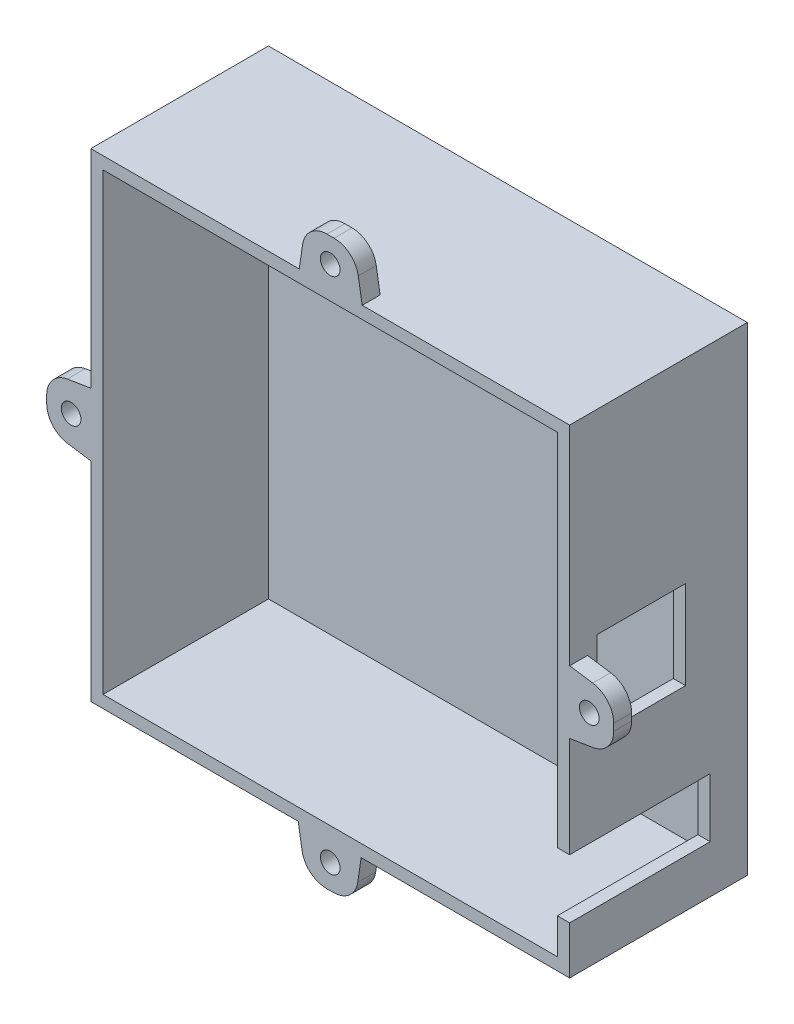
from build123d import *

# Parameters (mm, degrees)
BOSS_EXTRUDE1_START = -40.195413
SKETCH2_R           = 2.54
SKETCH2_W           = 117.366510392
SKETCH2_H           = 117.366510392
BOSS_EXTRUDE1_DEPTH = 40.195413
SKETCH8_W           = 123.716510392
SKETCH8_H           = 123.716510392
SKETCH8_W_2         = 117.366510392
SKETCH8_H_2         = 117.366510392
BOSS_EXTRUDE6_DEPTH = 38.1
SKETCH9_W           = 123.716510392
SKETCH9_H           = 123.716510392
BOSS_EXTRUDE7_DEPTH = 3.175
SKETCH11_W          = 203.085481381
SKETCH11_H          = 253.856851726
CUT_EXTRUDE3_DEPTH  = 35.56
SKETCH14_W          = 36.322
SKETCH14_H          = 15.24
SKETCH14_W_2        = 22.86
SKETCH14_H_2        = 22.86
CUT_EXTRUDE4_DEPTH  = 12.7


with BuildPart() as part:
    # Sketch2 → Boss-Extrude1 (new body)
    with BuildSketch(Plane.XY.offset(BOSS_EXTRUDE1_START)):
        with BuildLine():
            Line((1514.374964129, -9.898719074), (1513.372529957, -3.825593235))
            ThreePointArc((1513.372529957, -3.825593235), (1511.215570373, -0.017767746), (1507.107304519, 1.490264506))
            Line((1507.107304519, 1.490264506), (1506.145090959, 1.490264506))
            Line((1506.145090959, 1.490264506), (1505.274868714, 1.490264506))
            ThreePointArc((1505.274868714, 1.490264506), (1501.126253206, -0.052294453), (1498.993223216, -3.930526246))
            Line((1498.993223216, -3.930526246), (1498.110381295, -9.898719074))
            Line((1498.110381295, -9.898719074), (1494.935381295, -9.898719074))
            Line((1494.935381295, -9.898719074), (1444.2526074, -9.898719074))
            Line((1444.2526074, -9.898719074), (1444.2526074, -59.236149034))
            Line((1444.2526074, -59.236149034), (1444.2526074, -63.492872737))
            Line((1444.2526074, -63.492872737), (1438.179481561, -64.495306909))
            ThreePointArc((1438.179481561, -64.495306909), (1434.371656072, -66.652266493), (1432.86362382, -70.760532347))
            Line((1432.86362382, -70.760532347), (1432.86362382, -71.722745907))
            Line((1432.86362382, -71.722745907), (1432.86362382, -72.592968152))
            ThreePointArc((1432.86362382, -72.592968152), (1434.406182779, -76.74158366), (1438.284414571, -78.874613651))
            Line((1438.284414571, -78.874613651), (1444.2526074, -79.757455571))
            Line((1444.2526074, -79.757455571), (1444.2526074, -82.932455571))
            Line((1444.2526074, -82.932455571), (1444.2526074, -133.615229466))
            Line((1444.2526074, -133.615229466), (1493.590037359, -133.615229466))
            Line((1493.590037359, -133.615229466), (1497.846761063, -133.615229466))
            Line((1497.846761063, -133.615229466), (1498.849195235, -139.688355305))
            ThreePointArc((1498.849195235, -139.688355305), (1501.006154818, -143.496180794), (1505.114420673, -145.004213046))
            Line((1505.114420673, -145.004213046), (1506.076634233, -145.004213046))
            Line((1506.076634233, -145.004213046), (1506.946856478, -145.004213046))
            ThreePointArc((1506.946856478, -145.004213046), (1511.095471986, -143.461654087), (1513.228501976, -139.583422295))
            Line((1513.228501976, -139.583422295), (1514.111343897, -133.615229466))
            Line((1514.111343897, -133.615229466), (1517.286343897, -133.615229466))
            Line((1517.286343897, -133.615229466), (1567.969117792, -133.615229466))
            Line((1567.969117792, -133.615229466), (1567.969117792, -84.277799507))
            Line((1567.969117792, -84.277799507), (1567.969117792, -80.021075803))
            Line((1567.969117792, -80.021075803), (1574.042243631, -79.018641631))
            ThreePointArc((1574.042243631, -79.018641631), (1577.85006912, -76.861682048), (1579.358101372, -72.753416193))
            Line((1579.358101372, -72.753416193), (1579.358101372, -71.791202633))
            Line((1579.358101372, -71.791202633), (1579.358101372, -70.920980388))
            ThreePointArc((1579.358101372, -70.920980388), (1577.815542413, -66.77236488), (1573.93731062, -64.63933489))
            Line((1573.93731062, -64.63933489), (1567.969117792, -63.756492969))
            Line((1567.969117792, -63.756492969), (1567.969117792, -60.581492969))
            Line((1567.969117792, -60.581492969), (1567.969117792, -9.898719074))
            Line((1567.969117792, -9.898719074), (1518.631687833, -9.898719074))
            Line((1518.631687833, -9.898719074), (1514.374964129, -9.898719074))
        make_face()
        with Locations((1506.110862596, -138.695229466)):
            Circle(SKETCH2_R, mode=Mode.SUBTRACT)
        with Locations((1439.1726074, -71.75697427)):
            Circle(SKETCH2_R, mode=Mode.SUBTRACT)
        with Locations((1506.110862596, -71.75697427)):
            Rectangle(SKETCH2_W, SKETCH2_H, mode=Mode.SUBTRACT)
        with Locations((1506.110862596, -4.818719074)):
            Circle(SKETCH2_R, mode=Mode.SUBTRACT)
        with Locations((1573.049117792, -71.75697427)):
            Circle(SKETCH2_R, mode=Mode.SUBTRACT)
    extrude(amount=BOSS_EXTRUDE1_DEPTH)

    # Sketch8 → Boss-Extrude6 (add)
    with BuildSketch(Plane(origin=(0, 0, -40.195413), x_dir=(-1, 0, 0), z_dir=(0, 0, -1))):
        with Locations((-1506.110862596, -71.75697427)):
            Rectangle(SKETCH8_W, SKETCH8_H)
        with Locations((-1506.110862596, -71.75697427)):
            Rectangle(SKETCH8_W_2, SKETCH8_H_2, mode=Mode.SUBTRACT)
    extrude(amount=BOSS_EXTRUDE6_DEPTH)

    # Sketch9 → Boss-Extrude7 (add)
    with BuildSketch(Plane(origin=(0, 0, -78.295413), x_dir=(-1, 0, 0), z_dir=(0, 0, -1))):
        with Locations((-1506.110862596, -71.75697427)):
            Rectangle(SKETCH9_W, SKETCH9_H)
    extrude(amount=BOSS_EXTRUDE7_DEPTH)

    # Sketch11 → Cut-Extrude3 (cut)
    with BuildSketch(Plane.XY):
        with Locations((1484.541394478, -61.275179675)):
            Rectangle(SKETCH11_W, SKETCH11_H)
    extrude(amount=-CUT_EXTRUDE3_DEPTH, mode=Mode.SUBTRACT)

    # Sketch14 → Cut-Extrude4 (cut)
    with BuildSketch(Plane(origin=(1567.969117792, 0, 0), x_dir=(0, 0, -1), z_dir=(1, 0, 0))):
        with Locations((53.721, -113.66697427)):
            Rectangle(SKETCH14_W, SKETCH14_H)
        with Locations((54.102, -71.75697427)):
            Rectangle(SKETCH14_W_2, SKETCH14_H_2)
    extrude(amount=-CUT_EXTRUDE4_DEPTH, mode=Mode.SUBTRACT)


solid = part.part
